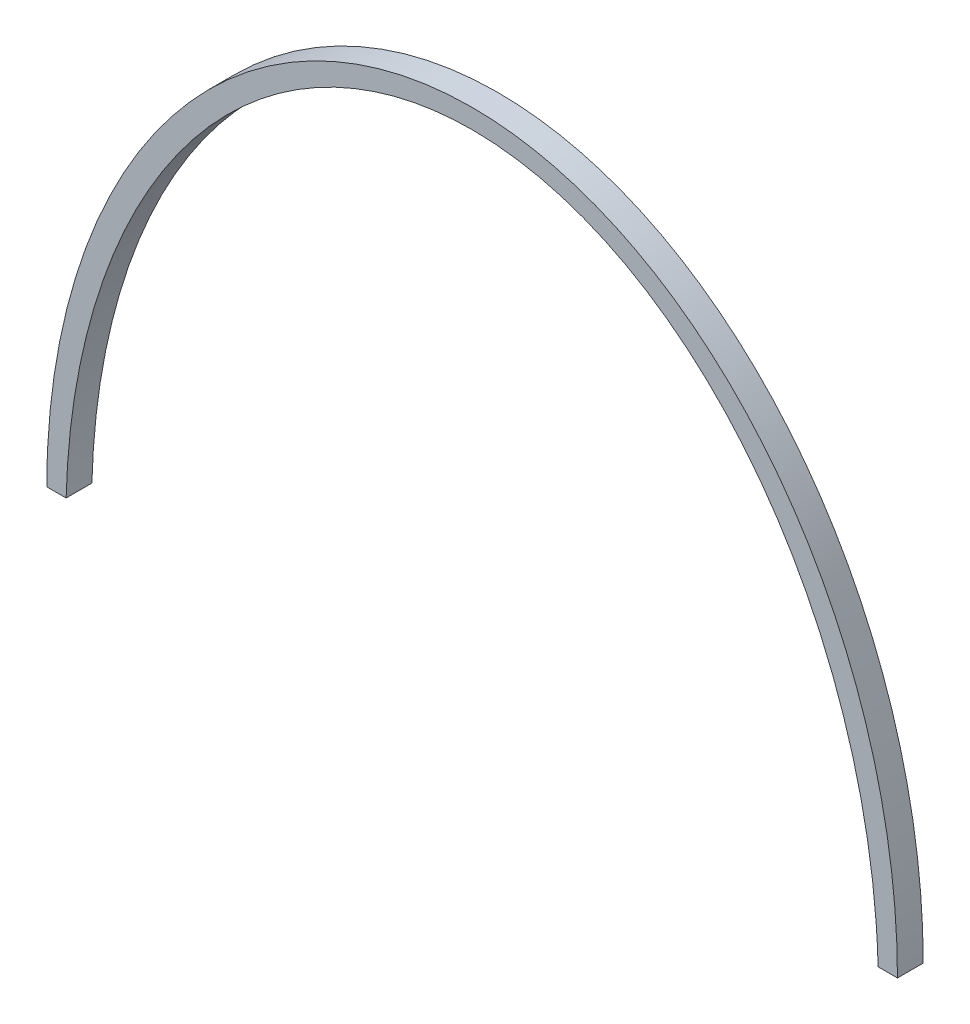
from build123d import *

# Parameters (mm, degrees)
BOSS_EXTRUDE1_DEPTH = 12.7


with BuildPart() as part:
    # Sketch1 → Boss-Extrude1 (new, symmetric)
    with BuildSketch(Plane.XY):
        with BuildLine():
            Line((400.05, 0), (419.1, 0))
            add(Edge.make_bspline(
                [(419.1, 0), (419.1, 533.4), (0, 533.4), (-419.1, 533.4), (-419.1, 0)],
                knots=[1.570796327, 1.570796327, 1.570796327, 3.141592654, 3.141592654, 4.71238898, 4.71238898, 4.71238898], degree=2, weights=[1, 0.707106781, 1, 0.707106781, 1]))
            Line((-419.1, 0), (-400.05, 0))
            add(Edge.make_bspline(
                [(400.05, 0), (386.255172414, 514.35), (0, 514.35), (-386.255172414, 514.35), (-400.05, 0)],
                knots=[1.606518209, 1.606518209, 1.606518209, 3.141592654, 3.141592654, 4.676667098, 4.676667098, 4.676667098], degree=2, weights=[1, 0.719622917, 1, 0.719622917, 1]))
        make_face()
    extrude(amount=BOSS_EXTRUDE1_DEPTH, both=True)


solid = part.part
